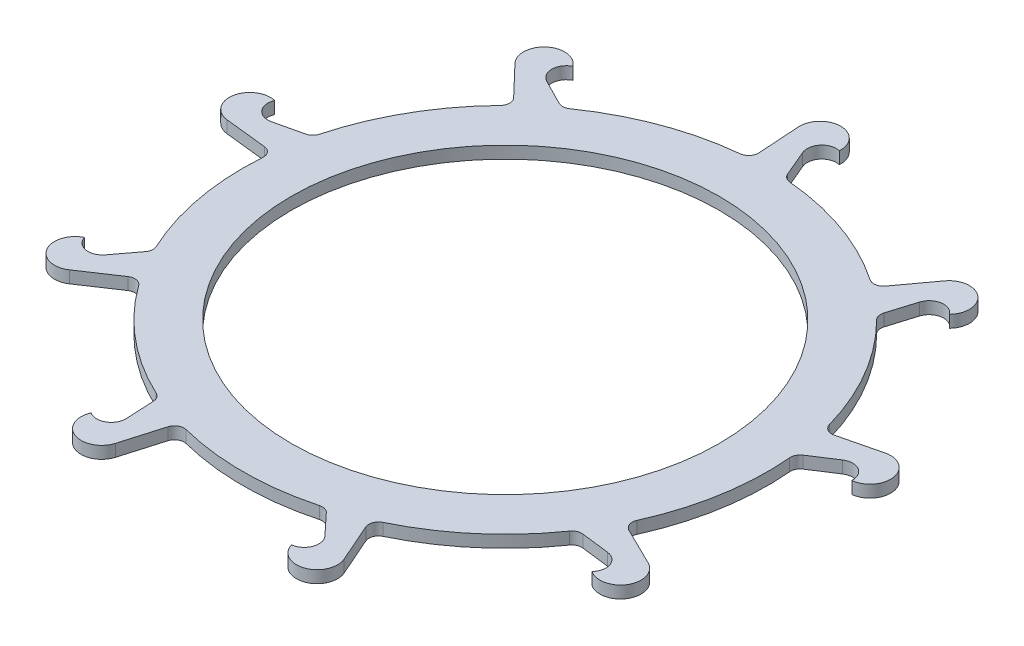
from build123d import *

# Parameters (mm, degrees)
SKETCH1_R           = 68.659375
SKETCH1_R_2         = 55.959375
BOSS_EXTRUDE1_DEPTH = 3.175
BOSS_EXTRUDE2_START = -3.175
BOSS_EXTRUDE2_DEPTH = 3.175
CIRPATTERN1_COUNT   = 9


with BuildPart() as part:
    # Sketch1 → Boss-Extrude1 (new body)
    with BuildSketch(Plane(origin=(0, 0, 0), x_dir=(1, 0, 0), z_dir=(0, 1, 0))):
        with Locations(Location((0, 0, 0), (0, 0, 270))):
            Circle(SKETCH1_R)
        with Locations(Location((0, 0, 0), (0, 0, 270))):
            Circle(SKETCH1_R_2, mode=Mode.SUBTRACT)
    extrude(amount=BOSS_EXTRUDE1_DEPTH)

    # Sketch2 → Boss-Extrude2 (add)
    with BuildSketch(Plane(origin=(0, 3.175, 0), x_dir=(1, 0, 0), z_dir=(0, 1, 0)).offset(BOSS_EXTRUDE2_START)):
        with BuildLine():
            Line((-4.653697789, 71.001707707), (-5.372788209, 81.972907412))
            ThreePointArc((-5.372788209, 81.972907412), (0, 87.709375), (5.372788209, 81.972907412))
            ThreePointArc((5.372788209, 81.972907412), (1.580107525, 80.725221164), (0.983574692, 76.777399446))
            Line((0.983574692, 76.777399446), (3.889375, 69.933810414))
            ThreePointArc((3.889375, 69.933810414), (4.734169071, 68.871766239), (6.005193091, 68.39625305))
            ThreePointArc((6.005193091, 68.39625305), (-0.46538454, 68.657797755), (-6.931822104, 68.308561818))
            ThreePointArc((-6.931822104, 68.308561818), (-5.249012804, 69.195180628), (-4.653697789, 71.001707707))
        make_face()
    boss_extrude2 = extrude(amount=BOSS_EXTRUDE2_DEPTH)

    # CirPattern1: Boss-Extrude2 ×9 about axis
    cirpattern1_axis = Axis((0, 0, 0), (0, 1, 0))
    for i in range(1, CIRPATTERN1_COUNT):
        add(boss_extrude2.rotate(cirpattern1_axis, i * 360 / CIRPATTERN1_COUNT))


solid = part.part
